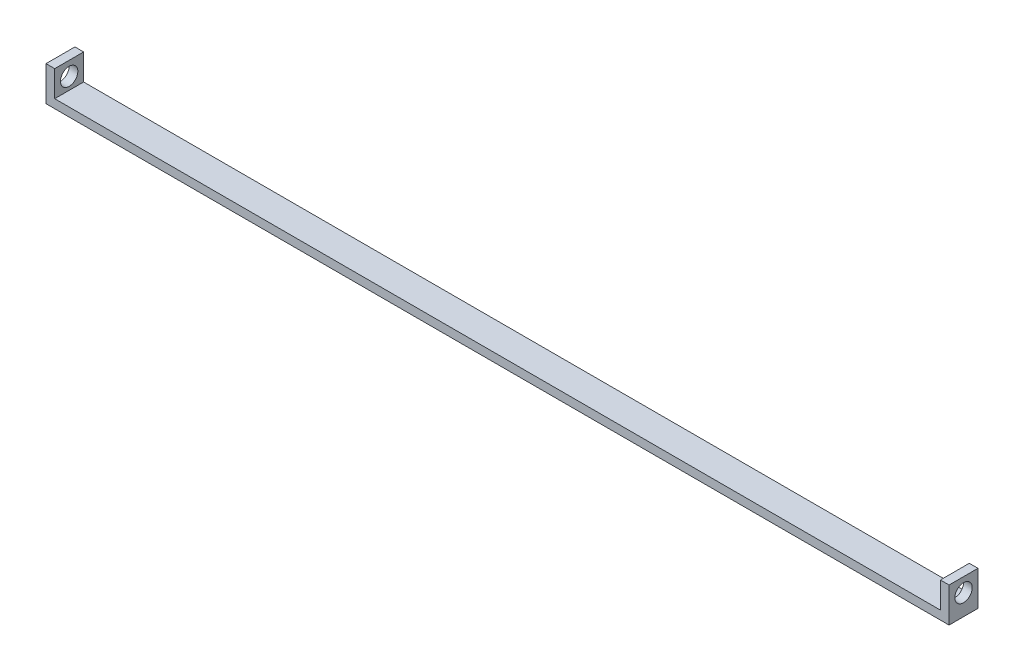
from build123d import *

# Parameters (mm, degrees)
EXTRUDE_1_DEPTH     = 5
SKETCH_2_R          = 1.5
CUT_EXTRUDE_1_DEPTH = 318


with BuildPart() as part:
    # 草图1 → 凸台-拉伸1 (new body)
    with BuildSketch(Plane.XY):
        Polygon((78, 5.370967742), (76.5, 5.370967742), (76.5, 0.870967742), (-76.5, 0.870967742), (-76.5, 5.370967742), (-78, 5.370967742), (-78, 0.629032258), (-78, -0.629032258), (78, -0.629032258), (78, 0.629032258), align=None)
    extrude(amount=EXTRUDE_1_DEPTH)

    # 草图2 → 切除-拉伸1 (cut)
    with BuildSketch(Plane.ZY.offset(78)):
        with Locations((2.5, 2.970967742)):
            Circle(SKETCH_2_R)
    extrude(amount=-CUT_EXTRUDE_1_DEPTH, mode=Mode.SUBTRACT)


solid = part.part
